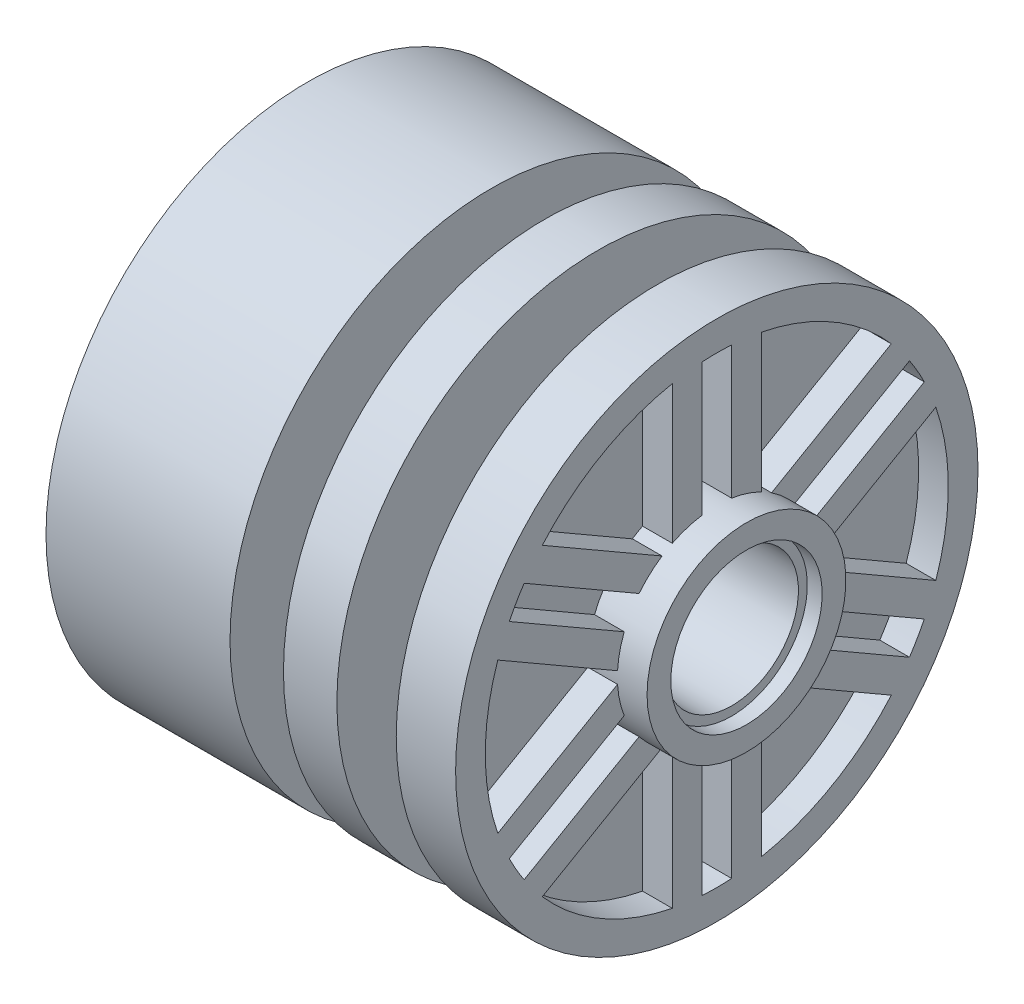
from build123d import *

# Parameters (mm, degrees)
BOSS_EXTRUDE2_DEPTH = 1
CIRPATTERN1_COUNT   = 6
SKETCH3_W           = 1.8
SKETCH3_H           = 7.2
CUT_EXTRUDE1_DEPTH  = 24.055801873
SKETCH4_R           = 1.2
CUT_EXTRUDE2_DEPTH  = 0.4
CIRPATTERN2_COUNT   = 6


with BuildPart() as part:
    # Sketch1 → Revolve1 (revolve)
    with BuildSketch(Plane.XY, mode=Mode.PRIVATE) as revolve1_sk:
        Polygon((15.8, 3.35), (15.8, 2.55), (15.3, 2.55), (15.3, 2.25), (0.5, 2.25), (0.5, 2.55), (0, 2.55), (0, 3.35), (6.3, 3.35), (6.3, 7.8), (1, 7.8), (1, 8.8), (7.2, 8.8), (7.2, 5.5), (9, 5.5), (9, 8.8), (10.8, 8.8), (10.8, 5.5), (12.8, 5.5), (12.8, 8.8), (14.8, 8.8), (14.8, 7.8), (13.8, 7.8), (13.8, 3.35), align=None)
    revolve(revolve1_sk.sketch.rotate(Axis((0, 0, 0), (1, 0, 0)), 90), axis=Axis((0, 0, 0), (1, 0, 0)))

    # Sketch2 → Boss-Extrude2 (add)
    with BuildSketch(Plane(origin=(13.8, 0, 0), x_dir=(0, 0, -1), z_dir=(1, 0, 0))):
        with BuildLine():
            Line((-1.5, 7.654410493), (-1.5, 2.99541316))
            ThreePointArc((-1.5, 2.99541316), (-1.012488161, 3.193331759), (-0.5, 3.312476415))
            Line((-0.5, 3.312476415), (-0.5, 7.783957862))
            ThreePointArc((-0.5, 7.783957862), (-1.002095619, 7.735360649), (-1.5, 7.654410493))
        make_face()
        with BuildLine():
            Line((0.5, 7.783957862), (0.5, 3.312476415))
            ThreePointArc((0.5, 3.312476415), (1.012469043, 3.193337821), (1.5, 2.99541316))
            Line((1.5, 2.99541316), (1.5, 7.654410493))
            ThreePointArc((1.5, 7.654410493), (1.002095619, 7.735360649), (0.5, 7.783957862))
        make_face()
    boss_extrude2 = extrude(amount=BOSS_EXTRUDE2_DEPTH)

    # CirPattern1: Boss-Extrude2 ×6 about axis
    cirpattern1_axis = Axis((0, 0, 0), (1, 0, 0))
    for i in range(1, CIRPATTERN1_COUNT):
        add(boss_extrude2.rotate(cirpattern1_axis, i * 360 / CIRPATTERN1_COUNT))

    # Sketch3 → Cut-Extrude1 (cut, through all)
    with BuildSketch(Plane(origin=(0, 5.5, 0), x_dir=(1, 0, 0), z_dir=(0, 1, 0))):
        with Locations((8.1, 0)):
            Rectangle(SKETCH3_W, SKETCH3_H)
    extrude(amount=-CUT_EXTRUDE1_DEPTH, mode=Mode.SUBTRACT)

    # Sketch4 → Cut-Extrude2 (cut)
    with BuildSketch(Plane.ZY.offset(-6.3)):
        with Locations((0, 6)):
            Circle(SKETCH4_R)
    cut_extrude2 = extrude(amount=-CUT_EXTRUDE2_DEPTH, mode=Mode.SUBTRACT)

    # CirPattern2: Cut-Extrude2 ×6 about axis
    cirpattern2_axis = Axis((0, 0, 0), (1, 0, 0))
    for i in range(1, CIRPATTERN2_COUNT):
        add(cut_extrude2.rotate(cirpattern2_axis, i * 360 / CIRPATTERN2_COUNT), mode=Mode.SUBTRACT)


solid = part.part
